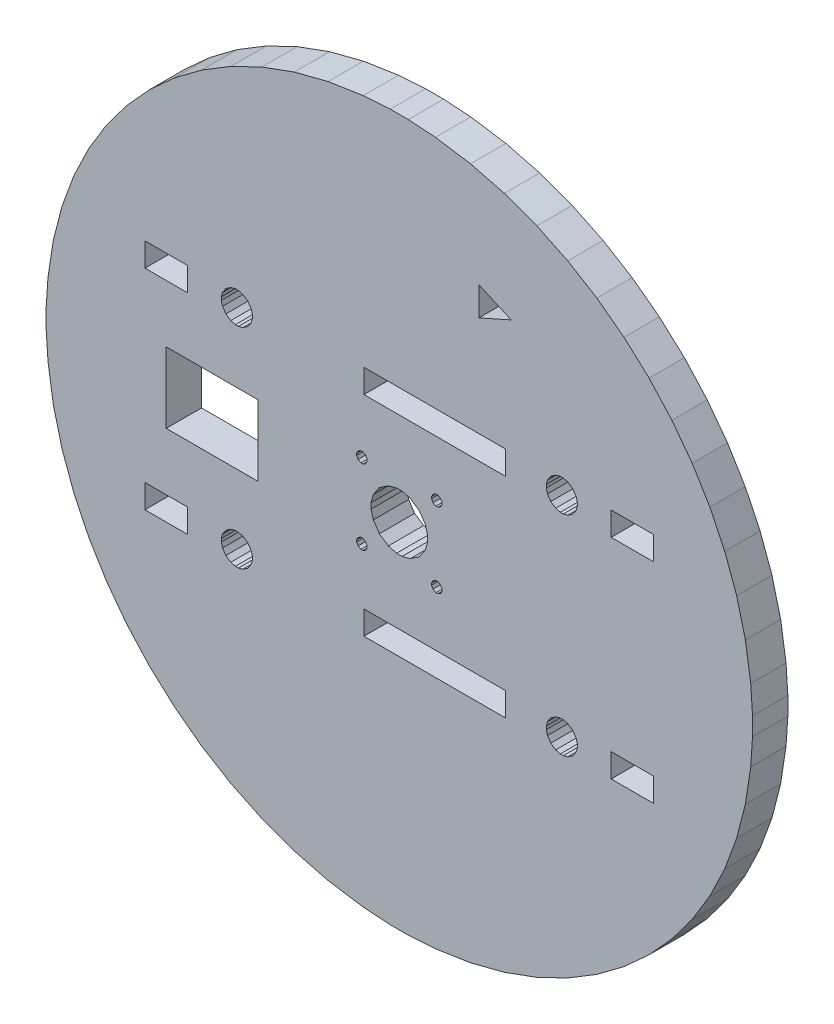
from build123d import *

# Parameters (mm, degrees)
SKETCH1_W           = 12.999212
SKETCH1_H           = 9.996424
SKETCH1_W_2         = 6.02615
SKETCH1_H_2         = 3.350514
SKETCH1_W_3         = 6.026404
SKETCH1_W_4         = 20.025868
SKETCH1_H_3         = 3.350006
BOSS_EXTRUDE1_DEPTH = 5


with BuildPart() as part:
    # Sketch1 → Boss-Extrude1 (new body)
    with BuildSketch(Plane.XY):
        Polygon((50.000154, -0.000889), (50.000154, 1.278001), (49.74082, 5.111877), (48.982884, 10.076815), (47.750984, 14.868271), (46.069758, 19.462623), (43.964098, 23.833709), (41.46042, 27.955367), (38.58133, 31.804483), (35.354006, 35.355657), (31.804102, 38.582727), (27.95397, 41.461817), (23.832312, 43.965495), (19.461226, 46.071155), (14.868398, 47.752381), (10.076942, 48.984281), (5.111496, 49.742217), (1.277874, 50.000027), (0.000508, 50.000027), (-1.278382, 50.000027), (-5.112004, 49.742217), (-10.076942, 48.984281), (-14.868398, 47.752381), (-19.463004, 46.071155), (-23.833836, 43.965495), (-27.955748, 41.461817), (-31.80461, 38.582727), (-35.356038, 35.355657), (-38.583108, 31.804483), (-41.461944, 27.955367), (-43.965876, 23.833709), (-46.071536, 19.462623), (-47.752508, 14.868271), (-48.984408, 10.076815), (-49.742598, 5.111877), (-50.000154, 1.278001), (-50.000154, -0.000889), (-50.000154, -1.278255), (-49.742598, -5.111877), (-48.984408, -10.077069), (-47.752508, -14.868271), (-46.071536, -19.461607), (-43.965876, -23.832439), (-41.461944, -27.954351), (-38.583108, -31.804483), (-35.356038, -35.354133), (-31.80461, -38.581711), (-27.955748, -41.460293), (-23.833836, -43.964479), (-19.463004, -46.069885), (-14.868398, -47.751111), (-10.076942, -48.983011), (-5.112004, -49.741201), (-1.278382, -50.000027), (0.000508, -50.000027), (1.277874, -50.000027), (5.111496, -49.741201), (10.076942, -48.983011), (14.868398, -47.751111), (19.461226, -46.069885), (23.832312, -43.964479), (27.95397, -41.460293), (31.804102, -38.581711), (35.354006, -35.355657), (38.58133, -31.804483), (41.46042, -27.955621), (43.964098, -23.832439), (46.069758, -19.462877), (47.750984, -14.868271), (48.982884, -10.077069), (49.74082, -5.111877), (50.000154, -1.278255), align=None)
        with Locations((-26.49982, 0.001905)):
            Rectangle(SKETCH1_W, SKETCH1_H, mode=Mode.SUBTRACT)
        Polygon((11.246612, 30.671643), (11.246612, 34.756217), (15.825724, 32.715327), align=None, mode=Mode.SUBTRACT)
        Polygon((4.001008, -0.000889), (4.001008, 0.389255), (3.685286, 1.556131), (2.82829, 2.828417), (1.556258, 3.685667), (0.389382, 3.999611), (0.000508, 3.999611), (-0.389382, 3.999611), (-1.556766, 3.685667), (-2.828544, 2.828417), (-3.685794, 1.556131), (-3.999992, 0.389255), (-3.999992, -0.000889), (-3.999992, -0.389255), (-3.685794, -1.556639), (-2.828544, -2.828417), (-1.556766, -3.684143), (-0.389382, -4.000119), (0.000508, -4.000119), (0.389382, -4.000119), (1.556258, -3.684143), (2.82829, -2.828417), (3.685286, -1.556639), (4.001008, -0.389255), align=None, mode=Mode.SUBTRACT)
        Polygon((-20.799552, 14.815693), (-20.799552, 15.030831), (-20.973288, 15.672943), (-21.444458, 16.372967), (-22.144482, 16.844137), (-22.786848, 17.016603), (-23.000208, 17.016603), (-23.215092, 17.016603), (-23.857458, 16.844137), (-24.555958, 16.372967), (-25.027382, 15.672943), (-25.199594, 15.030831), (-25.199594, 14.815693), (-25.199594, 14.602333), (-25.027382, 13.960221), (-24.555958, 13.261467), (-23.857458, 12.790043), (-23.215092, 12.616561), (-23.000208, 12.616561), (-22.786848, 12.616561), (-22.144482, 12.790043), (-21.444458, 13.261467), (-20.973288, 13.960221), (-20.799552, 14.602333), align=None, mode=Mode.SUBTRACT)
        Polygon((-20.799552, -14.811883), (-20.799552, -14.596999), (-20.973288, -13.954633), (-21.444458, -13.256133), (-22.144482, -12.784963), (-22.786848, -12.612751), (-23.000208, -12.612751), (-23.215092, -12.612751), (-23.857458, -12.784963), (-24.555958, -13.256133), (-25.027382, -13.954633), (-25.199594, -14.596999), (-25.199594, -14.811883), (-25.199594, -15.025497), (-25.027382, -15.667863), (-24.555958, -16.366363), (-23.857458, -16.837533), (-23.215092, -17.011269), (-23.000208, -17.011269), (-22.786848, -17.011269), (-22.144482, -16.837533), (-21.444458, -16.366363), (-20.973288, -15.667863), (-20.799552, -15.025497), align=None, mode=Mode.SUBTRACT)
        Polygon((25.200864, 14.815693), (25.200864, 15.030831), (25.027128, 15.672943), (24.555958, 16.372967), (23.85568, 16.844137), (23.213568, 17.016603), (22.999954, 17.016603), (22.78507, 17.016603), (22.142958, 16.844137), (21.444204, 16.372967), (20.97278, 15.672943), (20.800568, 15.030831), (20.800568, 14.815693), (20.800568, 14.602333), (20.97278, 13.960221), (21.444204, 13.261467), (22.142958, 12.790043), (22.78507, 12.616561), (22.999954, 12.616561), (23.213568, 12.616561), (23.85568, 12.790043), (24.555958, 13.261467), (25.027128, 13.960221), (25.200864, 14.602333), align=None, mode=Mode.SUBTRACT)
        Polygon((25.200864, -14.811883), (25.200864, -14.596999), (25.027128, -13.954633), (24.555958, -13.256133), (23.85568, -12.784963), (23.213568, -12.612751), (22.999954, -12.612751), (22.78507, -12.612751), (22.142958, -12.784963), (21.444204, -13.256133), (20.97278, -13.954633), (20.800568, -14.596999), (20.800568, -14.811883), (20.800568, -15.025497), (20.97278, -15.667863), (21.444204, -16.366363), (22.142958, -16.837533), (22.78507, -17.011269), (22.999954, -17.011269), (23.213568, -17.011269), (23.85568, -16.837533), (24.555958, -16.366363), (25.027128, -15.667863), (25.200864, -15.025497), align=None, mode=Mode.SUBTRACT)
        Polygon((6.05409, 5.305933), (6.05409, 5.439537), (5.833618, 5.836539), (5.435346, 6.055487), (5.303012, 6.055487), (5.169408, 6.055487), (4.772406, 5.836539), (4.553458, 5.439537), (4.553458, 5.305933), (4.553458, 5.173599), (4.772406, 4.775327), (5.169408, 4.556379), (5.303012, 4.556379), (5.435346, 4.556379), (5.833618, 4.775327), (6.05409, 5.173599), align=None, mode=Mode.SUBTRACT)
        Polygon((6.05409, -5.302123), (6.05409, -5.168519), (5.833618, -4.770247), (5.435346, -4.551045), (5.303012, -4.551045), (5.169408, -4.551045), (4.772406, -4.770247), (4.553458, -5.168519), (4.553458, -5.302123), (4.553458, -5.434457), (4.772406, -5.831205), (5.169408, -6.051677), (5.303012, -6.051677), (5.435346, -6.051677), (5.833618, -5.831205), (6.05409, -5.434457), align=None, mode=Mode.SUBTRACT)
        Polygon((-4.552442, -5.302123), (-4.552442, -5.168519), (-4.772914, -4.770247), (-5.171186, -4.551045), (-5.30352, -4.551045), (-5.437124, -4.551045), (-5.834126, -4.770247), (-6.053074, -5.168519), (-6.053074, -5.302123), (-6.053074, -5.434457), (-5.834126, -5.831205), (-5.437124, -6.051677), (-5.30352, -6.051677), (-5.171186, -6.051677), (-4.772914, -5.831205), (-4.552442, -5.434457), align=None, mode=Mode.SUBTRACT)
        Polygon((-4.552442, 5.305933), (-4.552442, 5.439537), (-4.772914, 5.836539), (-5.171186, 6.055487), (-5.30352, 6.055487), (-5.437124, 6.055487), (-5.834126, 5.836539), (-6.053074, 5.439537), (-6.053074, 5.305933), (-6.053074, 5.173599), (-5.834126, 4.775327), (-5.437124, 4.556379), (-5.30352, 4.556379), (-5.171186, 4.556379), (-4.772914, 4.775327), (-4.552442, 5.173599), align=None, mode=Mode.SUBTRACT)
        with Locations((-33.000061, 14.813788)):
            Rectangle(SKETCH1_W_2, SKETCH1_H_2, mode=Mode.SUBTRACT)
        with Locations((32.99968, 14.813788)):
            Rectangle(SKETCH1_W_3, SKETCH1_H_2, mode=Mode.SUBTRACT)
        with Locations((4.99999, 14.813788)):
            Rectangle(SKETCH1_W_4, SKETCH1_H_2, mode=Mode.SUBTRACT)
        with Locations((-33.000061, -14.809724)):
            Rectangle(SKETCH1_W_2, SKETCH1_H_3, mode=Mode.SUBTRACT)
        with Locations((32.99968, -14.809724)):
            Rectangle(SKETCH1_W_3, SKETCH1_H_3, mode=Mode.SUBTRACT)
        with Locations((4.99999, -14.809724)):
            Rectangle(SKETCH1_W_4, SKETCH1_H_3, mode=Mode.SUBTRACT)
    extrude(amount=BOSS_EXTRUDE1_DEPTH)


solid = part.part
